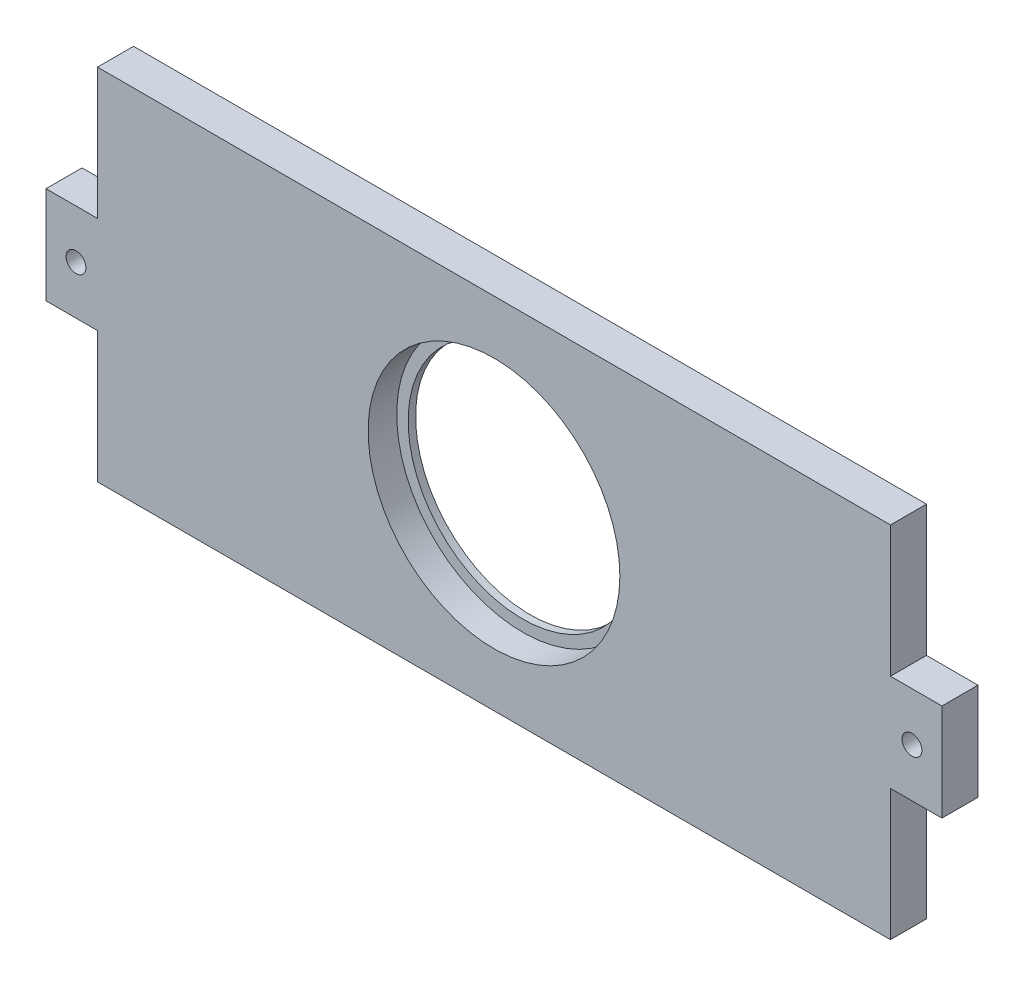
from build123d import *

# Parameters (mm, degrees)
SKETCH1_R           = 12.7
SKETCH1_R_2         = 1.1
BOSS_EXTRUDE1_DEPTH = 4
SKETCH2_R           = 13.97
CUT_EXTRUDE1_DEPTH  = 3.175


with BuildPart() as part:
    # Sketch1 → Boss-Extrude1 (new body)
    with BuildSketch(Plane.XY):
        Polygon((-44, 19.9319), (-44, 5.39), (-49.715, 5.39), (-49.715, -5.39), (-44, -5.39), (-44, -19.9319), (44, -19.9319), (44, -5.39), (49.715, -5.39), (49.715, 5.39), (44, 5.39), (44, 19.9319), align=None)
        Circle(SKETCH1_R, mode=Mode.SUBTRACT)
        with Locations((-46.3876, 0)):
            Circle(SKETCH1_R_2, mode=Mode.SUBTRACT)
        with Locations(Location((46.3876, 0, 0), (0, 0, 180))):
            Circle(SKETCH1_R_2, mode=Mode.SUBTRACT)
    extrude(amount=BOSS_EXTRUDE1_DEPTH)

    # Sketch2 → Cut-Extrude1 (cut)
    with BuildSketch(Plane.XY.offset(4)):
        Circle(SKETCH2_R)
    extrude(amount=-CUT_EXTRUDE1_DEPTH, mode=Mode.SUBTRACT)


solid = part.part
